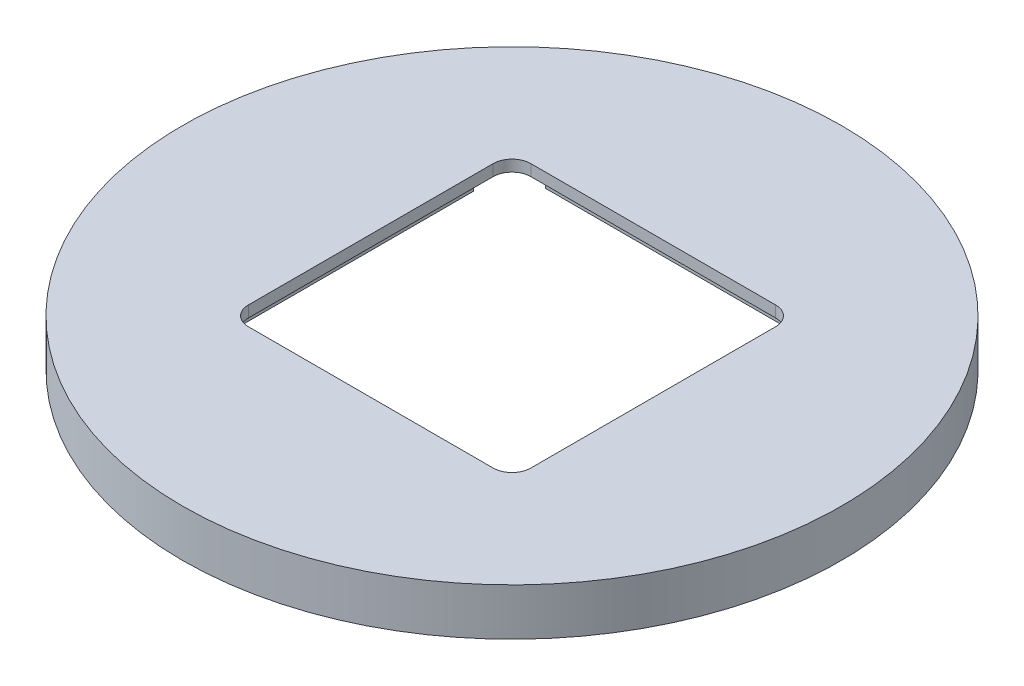
from build123d import *

# Parameters (mm, degrees)
SKETCH2_R           = 17.5
SKETCH2_W           = 18.5
SKETCH2_H           = 18.5
BOSS_EXTRUDE1_DEPTH = 2.5
SKETCH4_R           = 1.67
CUT_EXTRUDE1_DEPTH  = 1.15
CIRPATTERN1_COUNT   = 4
SKETCH5_W           = 18.5
SKETCH5_H           = 18.5
SKETCH5_W_2         = 15
SKETCH5_H_2         = 15
BOSS_EXTRUDE2_DEPTH = 0.6
FILLET1_R           = 1
SKETCH6_R           = 1.5
CUT_EXTRUDE2_DEPTH  = 1.9


with BuildPart() as part:
    # Sketch2 → Boss-Extrude1 (new body)
    with BuildSketch(Plane(origin=(0, 0, 0), x_dir=(1, 0, 0), z_dir=(0, 1, 0))):
        with Locations(Location((-21.383734207, -0.621346489, 0), (0, 0, 270))):
            Circle(SKETCH2_R)
        with Locations((-21.383734207, -0.621346489)):
            Rectangle(SKETCH2_W, SKETCH2_H, mode=Mode.SUBTRACT)
    extrude(amount=BOSS_EXTRUDE1_DEPTH)

    # Sketch4 → Cut-Extrude1 (cut)
    with BuildSketch(Plane.XZ):
        with Locations(Location((-21.569675845, 15.589648339, 0), (0, 0, 270))):
            Circle(SKETCH4_R)
    cut_extrude1 = extrude(amount=-CUT_EXTRUDE1_DEPTH, mode=Mode.SUBTRACT)

    # CirPattern1: Cut-Extrude1 ×4 about axis
    cirpattern1_axis = Axis((-21.383734207, 0, 0.621346489), (0, 1, 0))
    for i in range(1, CIRPATTERN1_COUNT):
        add(cut_extrude1.rotate(cirpattern1_axis, i * 360 / CIRPATTERN1_COUNT), mode=Mode.SUBTRACT)

    # Sketch5 → Boss-Extrude2 (add)
    with BuildSketch(Plane(origin=(0, 2.5, 0), x_dir=(1, 0, 0), z_dir=(0, 1, 0))):
        with Locations((-21.383734207, -0.621346489)):
            Rectangle(SKETCH5_W, SKETCH5_H)
        with Locations((-21.383734207, -0.621346489)):
            Rectangle(SKETCH5_W_2, SKETCH5_H_2, mode=Mode.SUBTRACT)
    extrude(amount=-BOSS_EXTRUDE2_DEPTH)

    # Fillet1
    fillet1_edges = [part.edges().sort_by_distance(p)[0] for p in [
        (-28.883734207, 2.2, -6.878653511),
        (-28.883734207, 2.2, 8.121346489),
        (-13.883734207, 2.2, 8.121346489),
        (-13.883734207, 2.2, -6.878653511),
    ]]
    fillet(fillet1_edges, radius=FILLET1_R)

    # Sketch6 → Cut-Extrude2 (cut)
    with BuildSketch(Plane(origin=(0, 0, 0), x_dir=(-1, 0, 0), z_dir=(0, -1, 0))):
        with Locations((30.133734207, -9.371346489)):
            Circle(SKETCH6_R)
        with Locations((12.733734207, -9.271346489)):
            Circle(SKETCH6_R)
        with Locations((12.833734207, 8.128653511)):
            Circle(SKETCH6_R)
        with Locations((30.233734207, 8.028653511)):
            Circle(SKETCH6_R)
    extrude(amount=-CUT_EXTRUDE2_DEPTH, mode=Mode.SUBTRACT)


solid = part.part
